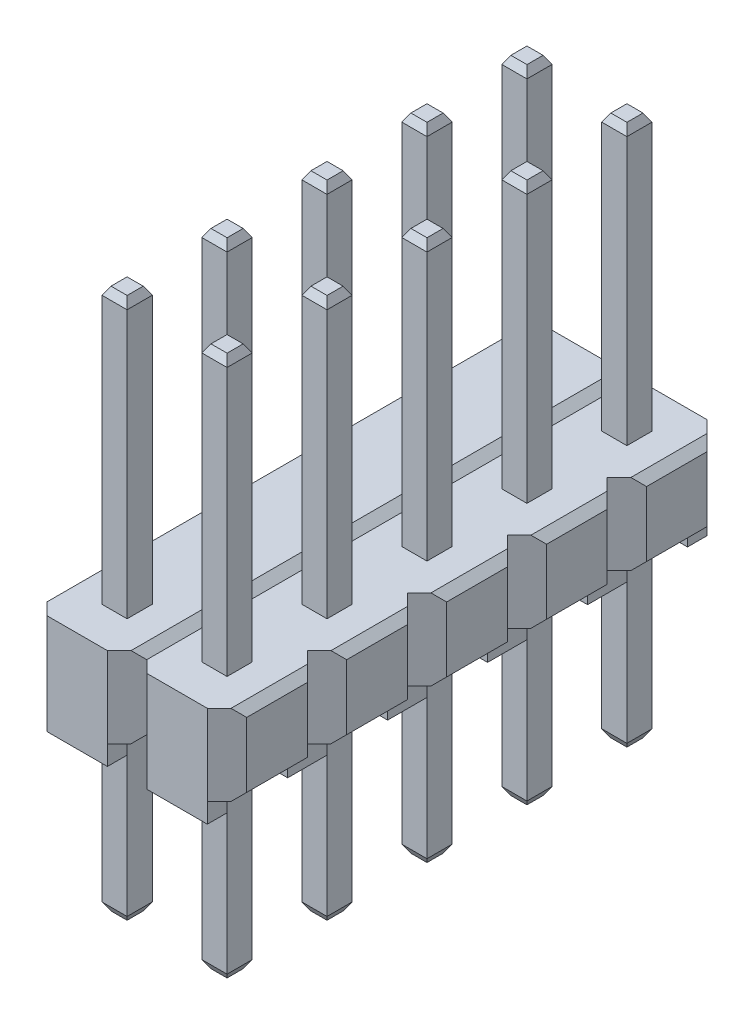
from build123d import *
from OCP.BRepFilletAPI import BRepFilletAPI_MakeChamfer

# Parameters (mm, degrees)
SKETCH1_W                = 0.64
SKETCH1_H                = 0.64
BOSS_EXTRUDE1_DEPTH      = 2.05
CUT_EXTRUDE1_DEPTH       = 10
SKETCH3_W                = 1.54
SKETCH3_H                = 0.5
SKETCH3_H_2              = 1
BOSS_EXTRUDE2_DEPTH      = 0.5
BOSS_EXTRUDE3_DEPTH      = 7
BOSS_EXTRUDE3_DEPTH_BACK = 6.75
SKETCH4_W                = 0.64
SKETCH4_H                = 0.64
CHAMFER1_SIZE            = 0.2
CHAMFER1_SIZE2           = 0.115470054
SKETCH5_R                = 0.125
CUT_EXTRUDE2_DEPTH       = 1
SCALE1_SCALE             = 0.5


with BuildPart() as part:
    # Sketch1 → Boss-Extrude1 (new body)
    with BuildSketch(Plane(origin=(0, 0, 0), x_dir=(1, 0, 0), z_dir=(0, 1, 0))):
        Polygon((2.04, 1.27), (2.54, 0.77), (2.54, -0.77), (2.04, -1.27), (2.54, -1.77), (2.54, -3.31), (2.04, -3.81), (2.54, -4.31), (2.54, -5.85), (2.04, -6.35), (0.5, -6.35), (0, -5.85), (-0.5, -6.35), (-2.04, -6.35), (-2.54, -5.85), (-2.54, -4.31), (-2.04, -3.81), (-2.54, -3.31), (-2.54, -1.77), (-2.04, -1.27), (-2.54, -0.77), (-2.54, 0.77), (-2.04, 1.27), (-2.54, 1.77), (-2.54, 3.31), (-2.04, 3.81), (-2.54, 4.31), (-2.54, 5.85), (-2.04, 6.35), (-0.5, 6.35), (0, 5.85), (0.5, 6.35), (2.04, 6.35), (2.54, 5.85), (2.54, 4.31), (2.04, 3.81), (2.54, 3.31), (2.54, 1.77), align=None)
        Polygon((0, 0.77), (0.5, 1.27), (0, 1.77), (-0.5, 1.27), align=None, mode=Mode.SUBTRACT)
        Polygon((0, 4.31), (-0.5, 3.81), (0, 3.31), (0.5, 3.81), align=None, mode=Mode.SUBTRACT)
        Polygon((0.5, -1.27), (0, -0.77), (-0.5, -1.27), (0, -1.77), align=None, mode=Mode.SUBTRACT)
        with Locations((-1.27, 0)):
            Rectangle(SKETCH1_W, SKETCH1_H, mode=Mode.SUBTRACT)
        with Locations((1.27, 0)):
            Rectangle(SKETCH1_W, SKETCH1_H, mode=Mode.SUBTRACT)
        with Locations((1.27, 5.08)):
            Rectangle(SKETCH1_W, SKETCH1_H, mode=Mode.SUBTRACT)
        with Locations((1.27, 2.54)):
            Rectangle(SKETCH1_W, SKETCH1_H, mode=Mode.SUBTRACT)
        with Locations((-1.27, 2.54)):
            Rectangle(SKETCH1_W, SKETCH1_H, mode=Mode.SUBTRACT)
        Polygon((0, -4.31), (0.5, -3.81), (0, -3.31), (-0.5, -3.81), align=None, mode=Mode.SUBTRACT)
        with Locations((-1.27, 5.08)):
            Rectangle(SKETCH1_W, SKETCH1_H, mode=Mode.SUBTRACT)
        with Locations((-1.27, -5.08)):
            Rectangle(SKETCH1_W, SKETCH1_H, mode=Mode.SUBTRACT)
        with Locations((1.27, -5.08)):
            Rectangle(SKETCH1_W, SKETCH1_H, mode=Mode.SUBTRACT)
        with Locations((1.27, -2.54)):
            Rectangle(SKETCH1_W, SKETCH1_H, mode=Mode.SUBTRACT)
        with Locations((-1.27, -2.54)):
            Rectangle(SKETCH1_W, SKETCH1_H, mode=Mode.SUBTRACT)
    extrude(amount=-BOSS_EXTRUDE1_DEPTH)

    # Sketch2 → Cut-Extrude1 (cut, symmetric)
    with BuildSketch(Plane.XY):
        Polygon((-2.54, -0.2), (-2.34, 0), (-2.54, 0), align=None)
        Polygon((-0.2, 0), (0.2, 0), (0, -0.2), align=None)
        Polygon((2.54, 0), (2.34, 0), (2.54, -0.2), align=None)
        Polygon((2.54, -1.85), (2.54, -2.05), (2.34, -2.05), align=None)
        Polygon((0, -1.85), (-0.2, -2.05), (0.2, -2.05), align=None)
        Polygon((-2.54, -2.05), (-2.54, -1.85), (-2.34, -2.05), align=None)
    extrude(amount=CUT_EXTRUDE1_DEPTH, both=True, mode=Mode.SUBTRACT)

    # Sketch3 → Boss-Extrude2 (add)
    with BuildSketch(Plane.XZ.offset(2.05)):
        with Locations((-1.27, 6.1)):
            Rectangle(SKETCH3_W, SKETCH3_H)
        with Locations((1.27, 6.1)):
            Rectangle(SKETCH3_W, SKETCH3_H)
        with Locations((-1.27, -1.27)):
            Rectangle(SKETCH3_W, SKETCH3_H_2)
        with Locations((1.27, -1.27)):
            Rectangle(SKETCH3_W, SKETCH3_H_2)
        with Locations((-1.27, -3.81)):
            Rectangle(SKETCH3_W, SKETCH3_H_2)
        with Locations((1.27, -3.81)):
            Rectangle(SKETCH3_W, SKETCH3_H_2)
        with Locations((-1.27, -6.1)):
            Rectangle(SKETCH3_W, SKETCH3_H)
        with Locations((1.27, -6.1)):
            Rectangle(SKETCH3_W, SKETCH3_H)
        with Locations((-1.27, 3.81)):
            Rectangle(SKETCH3_W, SKETCH3_H_2)
        with Locations((-1.27, 1.27)):
            Rectangle(SKETCH3_W, SKETCH3_H_2)
        with Locations((1.27, 3.81)):
            Rectangle(SKETCH3_W, SKETCH3_H_2)
        with Locations((1.27, 1.27)):
            Rectangle(SKETCH3_W, SKETCH3_H_2)
    extrude(amount=BOSS_EXTRUDE2_DEPTH)

    # Sketch4 → Boss-Extrude3 (add, two sides: drawn at the far end of the back side and taken through both)
    with BuildSketch(Plane(origin=(0, 0, 0), x_dir=(1, 0, 0), z_dir=(0, 1, 0)).offset(-BOSS_EXTRUDE3_DEPTH_BACK)):
        with Locations((-1.27, 5.08)):
            Rectangle(SKETCH4_W, SKETCH4_H)
        with Locations((1.27, 5.08)):
            Rectangle(SKETCH4_W, SKETCH4_H)
        with Locations((-1.27, 2.54)):
            Rectangle(SKETCH4_W, SKETCH4_H)
        with Locations((1.27, 2.54)):
            Rectangle(SKETCH4_W, SKETCH4_H)
        with Locations((-1.27, 0)):
            Rectangle(SKETCH4_W, SKETCH4_H)
        with Locations((1.27, 0)):
            Rectangle(SKETCH4_W, SKETCH4_H)
        with Locations((-1.27, -2.54)):
            Rectangle(SKETCH4_W, SKETCH4_H)
        with Locations((1.27, -2.54)):
            Rectangle(SKETCH4_W, SKETCH4_H)
        with Locations((-1.27, -5.08)):
            Rectangle(SKETCH4_W, SKETCH4_H)
        with Locations((1.27, -5.08)):
            Rectangle(SKETCH4_W, SKETCH4_H)
    extrude(amount=BOSS_EXTRUDE3_DEPTH + BOSS_EXTRUDE3_DEPTH_BACK)

    # Chamfer1: one chamfer whose edges measure the first distance from different faces: ONE call of the kernel's chamfer builder (chamfer() names one face for all edges)
    chamfer1_edges_1 = [part.edges().sort_by_distance(p)[0] for p in [
        (-1.59, -6.75, -5.08),
    ]]
    chamfer1_side_1 = [part.faces().sort_by_distance(p)[0] for p in [
        (-1.59, -4.4, -5.08),
    ]]
    chamfer1_edges_2 = [part.edges().sort_by_distance(p)[0] for p in [
        (-1.27, -6.75, -5.4),
    ]]
    chamfer1_side_2 = [part.faces().sort_by_distance(p)[0] for p in [
        (-1.27, -4.4, -5.4),
    ]]
    chamfer1_edges_3 = [part.edges().sort_by_distance(p)[0] for p in [
        (-0.95, -6.75, -5.08),
    ]]
    chamfer1_side_3 = [part.faces().sort_by_distance(p)[0] for p in [
        (-0.95, -4.4, -5.08),
    ]]
    chamfer1_edges_4 = [part.edges().sort_by_distance(p)[0] for p in [
        (-1.27, -6.75, -4.76),
    ]]
    chamfer1_side_4 = [part.faces().sort_by_distance(p)[0] for p in [
        (-1.27, -4.4, -4.76),
    ]]
    chamfer1_edges_5 = [part.edges().sort_by_distance(p)[0] for p in [
        (-1.59, 7, -5.08),
    ]]
    chamfer1_side_5 = [part.faces().sort_by_distance(p)[0] for p in [
        (-1.59, 3.5, -5.08),
    ]]
    chamfer1_edges_6 = [part.edges().sort_by_distance(p)[0] for p in [
        (-1.27, 7, -4.76),
    ]]
    chamfer1_side_6 = [part.faces().sort_by_distance(p)[0] for p in [
        (-1.27, 3.5, -4.76),
    ]]
    chamfer1_edges_7 = [part.edges().sort_by_distance(p)[0] for p in [
        (-0.95, 7, -5.08),
    ]]
    chamfer1_side_7 = [part.faces().sort_by_distance(p)[0] for p in [
        (-0.95, 3.5, -5.08),
    ]]
    chamfer1_edges_8 = [part.edges().sort_by_distance(p)[0] for p in [
        (-1.27, 7, -5.4),
    ]]
    chamfer1_side_8 = [part.faces().sort_by_distance(p)[0] for p in [
        (-1.27, 3.5, -5.4),
    ]]
    chamfer1_edges_9 = [part.edges().sort_by_distance(p)[0] for p in [
        (0.95, -6.75, -5.08),
    ]]
    chamfer1_side_9 = [part.faces().sort_by_distance(p)[0] for p in [
        (0.95, -4.4, -5.08),
    ]]
    chamfer1_edges_10 = [part.edges().sort_by_distance(p)[0] for p in [
        (1.27, -6.75, -5.4),
    ]]
    chamfer1_side_10 = [part.faces().sort_by_distance(p)[0] for p in [
        (1.27, -4.4, -5.4),
    ]]
    chamfer1_edges_11 = [part.edges().sort_by_distance(p)[0] for p in [
        (1.59, -6.75, -5.08),
    ]]
    chamfer1_side_11 = [part.faces().sort_by_distance(p)[0] for p in [
        (1.59, -4.4, -5.08),
    ]]
    chamfer1_edges_12 = [part.edges().sort_by_distance(p)[0] for p in [
        (1.27, -6.75, -4.76),
    ]]
    chamfer1_side_12 = [part.faces().sort_by_distance(p)[0] for p in [
        (1.27, -4.4, -4.76),
    ]]
    chamfer1_edges_13 = [part.edges().sort_by_distance(p)[0] for p in [
        (0.95, 7, -5.08),
    ]]
    chamfer1_side_13 = [part.faces().sort_by_distance(p)[0] for p in [
        (0.95, 3.5, -5.08),
    ]]
    chamfer1_edges_14 = [part.edges().sort_by_distance(p)[0] for p in [
        (1.27, 7, -4.76),
    ]]
    chamfer1_side_14 = [part.faces().sort_by_distance(p)[0] for p in [
        (1.27, 3.5, -4.76),
    ]]
    chamfer1_edges_15 = [part.edges().sort_by_distance(p)[0] for p in [
        (1.59, 7, -5.08),
    ]]
    chamfer1_side_15 = [part.faces().sort_by_distance(p)[0] for p in [
        (1.59, 3.5, -5.08),
    ]]
    chamfer1_edges_16 = [part.edges().sort_by_distance(p)[0] for p in [
        (1.27, 7, -5.4),
    ]]
    chamfer1_side_16 = [part.faces().sort_by_distance(p)[0] for p in [
        (1.27, 3.5, -5.4),
    ]]
    chamfer1_edges_17 = [part.edges().sort_by_distance(p)[0] for p in [
        (-1.59, -6.75, -2.54),
    ]]
    chamfer1_side_17 = [part.faces().sort_by_distance(p)[0] for p in [
        (-1.59, -4.4, -2.54),
    ]]
    chamfer1_edges_18 = [part.edges().sort_by_distance(p)[0] for p in [
        (-1.27, -6.75, -2.86),
    ]]
    chamfer1_side_18 = [part.faces().sort_by_distance(p)[0] for p in [
        (-1.27, -4.4, -2.86),
    ]]
    chamfer1_edges_19 = [part.edges().sort_by_distance(p)[0] for p in [
        (-0.95, -6.75, -2.54),
    ]]
    chamfer1_side_19 = [part.faces().sort_by_distance(p)[0] for p in [
        (-0.95, -4.4, -2.54),
    ]]
    chamfer1_edges_20 = [part.edges().sort_by_distance(p)[0] for p in [
        (-1.27, -6.75, -2.22),
    ]]
    chamfer1_side_20 = [part.faces().sort_by_distance(p)[0] for p in [
        (-1.27, -4.4, -2.22),
    ]]
    chamfer1_edges_21 = [part.edges().sort_by_distance(p)[0] for p in [
        (-1.59, 7, -2.54),
    ]]
    chamfer1_side_21 = [part.faces().sort_by_distance(p)[0] for p in [
        (-1.59, 3.5, -2.54),
    ]]
    chamfer1_edges_22 = [part.edges().sort_by_distance(p)[0] for p in [
        (-1.27, 7, -2.22),
    ]]
    chamfer1_side_22 = [part.faces().sort_by_distance(p)[0] for p in [
        (-1.27, 3.5, -2.22),
    ]]
    chamfer1_edges_23 = [part.edges().sort_by_distance(p)[0] for p in [
        (-0.95, 7, -2.54),
    ]]
    chamfer1_side_23 = [part.faces().sort_by_distance(p)[0] for p in [
        (-0.95, 3.5, -2.54),
    ]]
    chamfer1_edges_24 = [part.edges().sort_by_distance(p)[0] for p in [
        (-1.27, 7, -2.86),
    ]]
    chamfer1_side_24 = [part.faces().sort_by_distance(p)[0] for p in [
        (-1.27, 3.5, -2.86),
    ]]
    chamfer1_edges_25 = [part.edges().sort_by_distance(p)[0] for p in [
        (0.95, -6.75, -2.54),
    ]]
    chamfer1_side_25 = [part.faces().sort_by_distance(p)[0] for p in [
        (0.95, -4.4, -2.54),
    ]]
    chamfer1_edges_26 = [part.edges().sort_by_distance(p)[0] for p in [
        (1.27, -6.75, -2.86),
    ]]
    chamfer1_side_26 = [part.faces().sort_by_distance(p)[0] for p in [
        (1.27, -4.4, -2.86),
    ]]
    chamfer1_edges_27 = [part.edges().sort_by_distance(p)[0] for p in [
        (1.59, -6.75, -2.54),
    ]]
    chamfer1_side_27 = [part.faces().sort_by_distance(p)[0] for p in [
        (1.59, -4.4, -2.54),
    ]]
    chamfer1_edges_28 = [part.edges().sort_by_distance(p)[0] for p in [
        (1.27, -6.75, -2.22),
    ]]
    chamfer1_side_28 = [part.faces().sort_by_distance(p)[0] for p in [
        (1.27, -4.4, -2.22),
    ]]
    chamfer1_edges_29 = [part.edges().sort_by_distance(p)[0] for p in [
        (0.95, 7, -2.54),
    ]]
    chamfer1_side_29 = [part.faces().sort_by_distance(p)[0] for p in [
        (0.95, 3.5, -2.54),
    ]]
    chamfer1_edges_30 = [part.edges().sort_by_distance(p)[0] for p in [
        (1.27, 7, -2.22),
    ]]
    chamfer1_side_30 = [part.faces().sort_by_distance(p)[0] for p in [
        (1.27, 3.5, -2.22),
    ]]
    chamfer1_edges_31 = [part.edges().sort_by_distance(p)[0] for p in [
        (1.59, 7, -2.54),
    ]]
    chamfer1_side_31 = [part.faces().sort_by_distance(p)[0] for p in [
        (1.59, 3.5, -2.54),
    ]]
    chamfer1_edges_32 = [part.edges().sort_by_distance(p)[0] for p in [
        (1.27, 7, -2.86),
    ]]
    chamfer1_side_32 = [part.faces().sort_by_distance(p)[0] for p in [
        (1.27, 3.5, -2.86),
    ]]
    chamfer1_edges_33 = [part.edges().sort_by_distance(p)[0] for p in [
        (-1.59, -6.75, 0),
    ]]
    chamfer1_side_33 = [part.faces().sort_by_distance(p)[0] for p in [
        (-1.59, -4.4, 0),
    ]]
    chamfer1_edges_34 = [part.edges().sort_by_distance(p)[0] for p in [
        (-1.27, -6.75, -0.32),
    ]]
    chamfer1_side_34 = [part.faces().sort_by_distance(p)[0] for p in [
        (-1.27, -4.4, -0.32),
    ]]
    chamfer1_edges_35 = [part.edges().sort_by_distance(p)[0] for p in [
        (-0.95, -6.75, 0),
    ]]
    chamfer1_side_35 = [part.faces().sort_by_distance(p)[0] for p in [
        (-0.95, -4.4, 0),
    ]]
    chamfer1_edges_36 = [part.edges().sort_by_distance(p)[0] for p in [
        (-1.27, -6.75, 0.32),
    ]]
    chamfer1_side_36 = [part.faces().sort_by_distance(p)[0] for p in [
        (-1.27, -4.4, 0.32),
    ]]
    chamfer1_edges_37 = [part.edges().sort_by_distance(p)[0] for p in [
        (-1.59, 7, 0),
    ]]
    chamfer1_side_37 = [part.faces().sort_by_distance(p)[0] for p in [
        (-1.59, 3.5, 0),
    ]]
    chamfer1_edges_38 = [part.edges().sort_by_distance(p)[0] for p in [
        (-1.27, 7, 0.32),
    ]]
    chamfer1_side_38 = [part.faces().sort_by_distance(p)[0] for p in [
        (-1.27, 3.5, 0.32),
    ]]
    chamfer1_edges_39 = [part.edges().sort_by_distance(p)[0] for p in [
        (-0.95, 7, 0),
    ]]
    chamfer1_side_39 = [part.faces().sort_by_distance(p)[0] for p in [
        (-0.95, 3.5, 0),
    ]]
    chamfer1_edges_40 = [part.edges().sort_by_distance(p)[0] for p in [
        (-1.27, 7, -0.32),
    ]]
    chamfer1_side_40 = [part.faces().sort_by_distance(p)[0] for p in [
        (-1.27, 3.5, -0.32),
    ]]
    chamfer1_edges_41 = [part.edges().sort_by_distance(p)[0] for p in [
        (0.95, -6.75, 0),
    ]]
    chamfer1_side_41 = [part.faces().sort_by_distance(p)[0] for p in [
        (0.95, -4.4, 0),
    ]]
    chamfer1_edges_42 = [part.edges().sort_by_distance(p)[0] for p in [
        (1.27, -6.75, -0.32),
    ]]
    chamfer1_side_42 = [part.faces().sort_by_distance(p)[0] for p in [
        (1.27, -4.4, -0.32),
    ]]
    chamfer1_edges_43 = [part.edges().sort_by_distance(p)[0] for p in [
        (1.59, -6.75, 0),
    ]]
    chamfer1_side_43 = [part.faces().sort_by_distance(p)[0] for p in [
        (1.59, -4.4, 0),
    ]]
    chamfer1_edges_44 = [part.edges().sort_by_distance(p)[0] for p in [
        (1.27, -6.75, 0.32),
    ]]
    chamfer1_side_44 = [part.faces().sort_by_distance(p)[0] for p in [
        (1.27, -4.4, 0.32),
    ]]
    chamfer1_edges_45 = [part.edges().sort_by_distance(p)[0] for p in [
        (0.95, 7, 0),
    ]]
    chamfer1_side_45 = [part.faces().sort_by_distance(p)[0] for p in [
        (0.95, 3.5, 0),
    ]]
    chamfer1_edges_46 = [part.edges().sort_by_distance(p)[0] for p in [
        (1.27, 7, 0.32),
    ]]
    chamfer1_side_46 = [part.faces().sort_by_distance(p)[0] for p in [
        (1.27, 3.5, 0.32),
    ]]
    chamfer1_edges_47 = [part.edges().sort_by_distance(p)[0] for p in [
        (1.59, 7, 0),
    ]]
    chamfer1_side_47 = [part.faces().sort_by_distance(p)[0] for p in [
        (1.59, 3.5, 0),
    ]]
    chamfer1_edges_48 = [part.edges().sort_by_distance(p)[0] for p in [
        (1.27, 7, -0.32),
    ]]
    chamfer1_side_48 = [part.faces().sort_by_distance(p)[0] for p in [
        (1.27, 3.5, -0.32),
    ]]
    chamfer1_edges_49 = [part.edges().sort_by_distance(p)[0] for p in [
        (-1.59, -6.75, 2.54),
    ]]
    chamfer1_side_49 = [part.faces().sort_by_distance(p)[0] for p in [
        (-1.59, -4.4, 2.54),
    ]]
    chamfer1_edges_50 = [part.edges().sort_by_distance(p)[0] for p in [
        (-1.27, -6.75, 2.22),
    ]]
    chamfer1_side_50 = [part.faces().sort_by_distance(p)[0] for p in [
        (-1.27, -4.4, 2.22),
    ]]
    chamfer1_edges_51 = [part.edges().sort_by_distance(p)[0] for p in [
        (-0.95, -6.75, 2.54),
    ]]
    chamfer1_side_51 = [part.faces().sort_by_distance(p)[0] for p in [
        (-0.95, -4.4, 2.54),
    ]]
    chamfer1_edges_52 = [part.edges().sort_by_distance(p)[0] for p in [
        (-1.27, -6.75, 2.86),
    ]]
    chamfer1_side_52 = [part.faces().sort_by_distance(p)[0] for p in [
        (-1.27, -4.4, 2.86),
    ]]
    chamfer1_edges_53 = [part.edges().sort_by_distance(p)[0] for p in [
        (-1.59, 7, 2.54),
    ]]
    chamfer1_side_53 = [part.faces().sort_by_distance(p)[0] for p in [
        (-1.59, 3.5, 2.54),
    ]]
    chamfer1_edges_54 = [part.edges().sort_by_distance(p)[0] for p in [
        (-1.27, 7, 2.86),
    ]]
    chamfer1_side_54 = [part.faces().sort_by_distance(p)[0] for p in [
        (-1.27, 3.5, 2.86),
    ]]
    chamfer1_edges_55 = [part.edges().sort_by_distance(p)[0] for p in [
        (-0.95, 7, 2.54),
    ]]
    chamfer1_side_55 = [part.faces().sort_by_distance(p)[0] for p in [
        (-0.95, 3.5, 2.54),
    ]]
    chamfer1_edges_56 = [part.edges().sort_by_distance(p)[0] for p in [
        (-1.27, 7, 2.22),
    ]]
    chamfer1_side_56 = [part.faces().sort_by_distance(p)[0] for p in [
        (-1.27, 3.5, 2.22),
    ]]
    chamfer1_edges_57 = [part.edges().sort_by_distance(p)[0] for p in [
        (0.95, -6.75, 2.54),
    ]]
    chamfer1_side_57 = [part.faces().sort_by_distance(p)[0] for p in [
        (0.95, -4.4, 2.54),
    ]]
    chamfer1_edges_58 = [part.edges().sort_by_distance(p)[0] for p in [
        (1.27, -6.75, 2.22),
    ]]
    chamfer1_side_58 = [part.faces().sort_by_distance(p)[0] for p in [
        (1.27, -4.4, 2.22),
    ]]
    chamfer1_edges_59 = [part.edges().sort_by_distance(p)[0] for p in [
        (1.59, -6.75, 2.54),
    ]]
    chamfer1_side_59 = [part.faces().sort_by_distance(p)[0] for p in [
        (1.59, -4.4, 2.54),
    ]]
    chamfer1_edges_60 = [part.edges().sort_by_distance(p)[0] for p in [
        (1.27, -6.75, 2.86),
    ]]
    chamfer1_side_60 = [part.faces().sort_by_distance(p)[0] for p in [
        (1.27, -4.4, 2.86),
    ]]
    chamfer1_edges_61 = [part.edges().sort_by_distance(p)[0] for p in [
        (0.95, 7, 2.54),
    ]]
    chamfer1_side_61 = [part.faces().sort_by_distance(p)[0] for p in [
        (0.95, 3.5, 2.54),
    ]]
    chamfer1_edges_62 = [part.edges().sort_by_distance(p)[0] for p in [
        (1.27, 7, 2.86),
    ]]
    chamfer1_side_62 = [part.faces().sort_by_distance(p)[0] for p in [
        (1.27, 3.5, 2.86),
    ]]
    chamfer1_edges_63 = [part.edges().sort_by_distance(p)[0] for p in [
        (1.59, 7, 2.54),
    ]]
    chamfer1_side_63 = [part.faces().sort_by_distance(p)[0] for p in [
        (1.59, 3.5, 2.54),
    ]]
    chamfer1_edges_64 = [part.edges().sort_by_distance(p)[0] for p in [
        (1.27, 7, 2.22),
    ]]
    chamfer1_side_64 = [part.faces().sort_by_distance(p)[0] for p in [
        (1.27, 3.5, 2.22),
    ]]
    chamfer1_edges_65 = [part.edges().sort_by_distance(p)[0] for p in [
        (-1.59, -6.75, 5.08),
    ]]
    chamfer1_side_65 = [part.faces().sort_by_distance(p)[0] for p in [
        (-1.59, -4.4, 5.08),
    ]]
    chamfer1_edges_66 = [part.edges().sort_by_distance(p)[0] for p in [
        (-1.27, -6.75, 4.76),
    ]]
    chamfer1_side_66 = [part.faces().sort_by_distance(p)[0] for p in [
        (-1.27, -4.4, 4.76),
    ]]
    chamfer1_edges_67 = [part.edges().sort_by_distance(p)[0] for p in [
        (-0.95, -6.75, 5.08),
    ]]
    chamfer1_side_67 = [part.faces().sort_by_distance(p)[0] for p in [
        (-0.95, -4.4, 5.08),
    ]]
    chamfer1_edges_68 = [part.edges().sort_by_distance(p)[0] for p in [
        (-1.27, -6.75, 5.4),
    ]]
    chamfer1_side_68 = [part.faces().sort_by_distance(p)[0] for p in [
        (-1.27, -4.4, 5.4),
    ]]
    chamfer1_edges_69 = [part.edges().sort_by_distance(p)[0] for p in [
        (-1.59, 7, 5.08),
    ]]
    chamfer1_side_69 = [part.faces().sort_by_distance(p)[0] for p in [
        (-1.59, 3.5, 5.08),
    ]]
    chamfer1_edges_70 = [part.edges().sort_by_distance(p)[0] for p in [
        (-1.27, 7, 5.4),
    ]]
    chamfer1_side_70 = [part.faces().sort_by_distance(p)[0] for p in [
        (-1.27, 3.5, 5.4),
    ]]
    chamfer1_edges_71 = [part.edges().sort_by_distance(p)[0] for p in [
        (-0.95, 7, 5.08),
    ]]
    chamfer1_side_71 = [part.faces().sort_by_distance(p)[0] for p in [
        (-0.95, 3.5, 5.08),
    ]]
    chamfer1_edges_72 = [part.edges().sort_by_distance(p)[0] for p in [
        (-1.27, 7, 4.76),
    ]]
    chamfer1_side_72 = [part.faces().sort_by_distance(p)[0] for p in [
        (-1.27, 3.5, 4.76),
    ]]
    chamfer1_edges_73 = [part.edges().sort_by_distance(p)[0] for p in [
        (0.95, -6.75, 5.08),
    ]]
    chamfer1_side_73 = [part.faces().sort_by_distance(p)[0] for p in [
        (0.95, -4.4, 5.08),
    ]]
    chamfer1_edges_74 = [part.edges().sort_by_distance(p)[0] for p in [
        (1.27, -6.75, 4.76),
    ]]
    chamfer1_side_74 = [part.faces().sort_by_distance(p)[0] for p in [
        (1.27, -4.4, 4.76),
    ]]
    chamfer1_edges_75 = [part.edges().sort_by_distance(p)[0] for p in [
        (1.59, -6.75, 5.08),
    ]]
    chamfer1_side_75 = [part.faces().sort_by_distance(p)[0] for p in [
        (1.59, -4.4, 5.08),
    ]]
    chamfer1_edges_76 = [part.edges().sort_by_distance(p)[0] for p in [
        (1.27, -6.75, 5.4),
    ]]
    chamfer1_side_76 = [part.faces().sort_by_distance(p)[0] for p in [
        (1.27, -4.4, 5.4),
    ]]
    chamfer1_edges_77 = [part.edges().sort_by_distance(p)[0] for p in [
        (0.95, 7, 5.08),
    ]]
    chamfer1_side_77 = [part.faces().sort_by_distance(p)[0] for p in [
        (0.95, 3.5, 5.08),
    ]]
    chamfer1_edges_78 = [part.edges().sort_by_distance(p)[0] for p in [
        (1.27, 7, 5.4),
    ]]
    chamfer1_side_78 = [part.faces().sort_by_distance(p)[0] for p in [
        (1.27, 3.5, 5.4),
    ]]
    chamfer1_edges_79 = [part.edges().sort_by_distance(p)[0] for p in [
        (1.59, 7, 5.08),
    ]]
    chamfer1_side_79 = [part.faces().sort_by_distance(p)[0] for p in [
        (1.59, 3.5, 5.08),
    ]]
    chamfer1_edges_80 = [part.edges().sort_by_distance(p)[0] for p in [
        (1.27, 7, 4.76),
    ]]
    chamfer1_side_80 = [part.faces().sort_by_distance(p)[0] for p in [
        (1.27, 3.5, 4.76),
    ]]
    chamfer1 = BRepFilletAPI_MakeChamfer(part.part.solid().wrapped)
    for e in chamfer1_edges_1:
        chamfer1.Add(CHAMFER1_SIZE, CHAMFER1_SIZE2, e.wrapped, chamfer1_side_1[0].wrapped)  # the first distance lies on this face
    for e in chamfer1_edges_2:
        chamfer1.Add(CHAMFER1_SIZE, CHAMFER1_SIZE2, e.wrapped, chamfer1_side_2[0].wrapped)  # the first distance lies on this face
    for e in chamfer1_edges_3:
        chamfer1.Add(CHAMFER1_SIZE, CHAMFER1_SIZE2, e.wrapped, chamfer1_side_3[0].wrapped)  # the first distance lies on this face
    for e in chamfer1_edges_4:
        chamfer1.Add(CHAMFER1_SIZE, CHAMFER1_SIZE2, e.wrapped, chamfer1_side_4[0].wrapped)  # the first distance lies on this face
    for e in chamfer1_edges_5:
        chamfer1.Add(CHAMFER1_SIZE, CHAMFER1_SIZE2, e.wrapped, chamfer1_side_5[0].wrapped)  # the first distance lies on this face
    for e in chamfer1_edges_6:
        chamfer1.Add(CHAMFER1_SIZE, CHAMFER1_SIZE2, e.wrapped, chamfer1_side_6[0].wrapped)  # the first distance lies on this face
    for e in chamfer1_edges_7:
        chamfer1.Add(CHAMFER1_SIZE, CHAMFER1_SIZE2, e.wrapped, chamfer1_side_7[0].wrapped)  # the first distance lies on this face
    for e in chamfer1_edges_8:
        chamfer1.Add(CHAMFER1_SIZE, CHAMFER1_SIZE2, e.wrapped, chamfer1_side_8[0].wrapped)  # the first distance lies on this face
    for e in chamfer1_edges_9:
        chamfer1.Add(CHAMFER1_SIZE, CHAMFER1_SIZE2, e.wrapped, chamfer1_side_9[0].wrapped)  # the first distance lies on this face
    for e in chamfer1_edges_10:
        chamfer1.Add(CHAMFER1_SIZE, CHAMFER1_SIZE2, e.wrapped, chamfer1_side_10[0].wrapped)  # the first distance lies on this face
    for e in chamfer1_edges_11:
        chamfer1.Add(CHAMFER1_SIZE, CHAMFER1_SIZE2, e.wrapped, chamfer1_side_11[0].wrapped)  # the first distance lies on this face
    for e in chamfer1_edges_12:
        chamfer1.Add(CHAMFER1_SIZE, CHAMFER1_SIZE2, e.wrapped, chamfer1_side_12[0].wrapped)  # the first distance lies on this face
    for e in chamfer1_edges_13:
        chamfer1.Add(CHAMFER1_SIZE, CHAMFER1_SIZE2, e.wrapped, chamfer1_side_13[0].wrapped)  # the first distance lies on this face
    for e in chamfer1_edges_14:
        chamfer1.Add(CHAMFER1_SIZE, CHAMFER1_SIZE2, e.wrapped, chamfer1_side_14[0].wrapped)  # the first distance lies on this face
    for e in chamfer1_edges_15:
        chamfer1.Add(CHAMFER1_SIZE, CHAMFER1_SIZE2, e.wrapped, chamfer1_side_15[0].wrapped)  # the first distance lies on this face
    for e in chamfer1_edges_16:
        chamfer1.Add(CHAMFER1_SIZE, CHAMFER1_SIZE2, e.wrapped, chamfer1_side_16[0].wrapped)  # the first distance lies on this face
    for e in chamfer1_edges_17:
        chamfer1.Add(CHAMFER1_SIZE, CHAMFER1_SIZE2, e.wrapped, chamfer1_side_17[0].wrapped)  # the first distance lies on this face
    for e in chamfer1_edges_18:
        chamfer1.Add(CHAMFER1_SIZE, CHAMFER1_SIZE2, e.wrapped, chamfer1_side_18[0].wrapped)  # the first distance lies on this face
    for e in chamfer1_edges_19:
        chamfer1.Add(CHAMFER1_SIZE, CHAMFER1_SIZE2, e.wrapped, chamfer1_side_19[0].wrapped)  # the first distance lies on this face
    for e in chamfer1_edges_20:
        chamfer1.Add(CHAMFER1_SIZE, CHAMFER1_SIZE2, e.wrapped, chamfer1_side_20[0].wrapped)  # the first distance lies on this face
    for e in chamfer1_edges_21:
        chamfer1.Add(CHAMFER1_SIZE, CHAMFER1_SIZE2, e.wrapped, chamfer1_side_21[0].wrapped)  # the first distance lies on this face
    for e in chamfer1_edges_22:
        chamfer1.Add(CHAMFER1_SIZE, CHAMFER1_SIZE2, e.wrapped, chamfer1_side_22[0].wrapped)  # the first distance lies on this face
    for e in chamfer1_edges_23:
        chamfer1.Add(CHAMFER1_SIZE, CHAMFER1_SIZE2, e.wrapped, chamfer1_side_23[0].wrapped)  # the first distance lies on this face
    for e in chamfer1_edges_24:
        chamfer1.Add(CHAMFER1_SIZE, CHAMFER1_SIZE2, e.wrapped, chamfer1_side_24[0].wrapped)  # the first distance lies on this face
    for e in chamfer1_edges_25:
        chamfer1.Add(CHAMFER1_SIZE, CHAMFER1_SIZE2, e.wrapped, chamfer1_side_25[0].wrapped)  # the first distance lies on this face
    for e in chamfer1_edges_26:
        chamfer1.Add(CHAMFER1_SIZE, CHAMFER1_SIZE2, e.wrapped, chamfer1_side_26[0].wrapped)  # the first distance lies on this face
    for e in chamfer1_edges_27:
        chamfer1.Add(CHAMFER1_SIZE, CHAMFER1_SIZE2, e.wrapped, chamfer1_side_27[0].wrapped)  # the first distance lies on this face
    for e in chamfer1_edges_28:
        chamfer1.Add(CHAMFER1_SIZE, CHAMFER1_SIZE2, e.wrapped, chamfer1_side_28[0].wrapped)  # the first distance lies on this face
    for e in chamfer1_edges_29:
        chamfer1.Add(CHAMFER1_SIZE, CHAMFER1_SIZE2, e.wrapped, chamfer1_side_29[0].wrapped)  # the first distance lies on this face
    for e in chamfer1_edges_30:
        chamfer1.Add(CHAMFER1_SIZE, CHAMFER1_SIZE2, e.wrapped, chamfer1_side_30[0].wrapped)  # the first distance lies on this face
    for e in chamfer1_edges_31:
        chamfer1.Add(CHAMFER1_SIZE, CHAMFER1_SIZE2, e.wrapped, chamfer1_side_31[0].wrapped)  # the first distance lies on this face
    for e in chamfer1_edges_32:
        chamfer1.Add(CHAMFER1_SIZE, CHAMFER1_SIZE2, e.wrapped, chamfer1_side_32[0].wrapped)  # the first distance lies on this face
    for e in chamfer1_edges_33:
        chamfer1.Add(CHAMFER1_SIZE, CHAMFER1_SIZE2, e.wrapped, chamfer1_side_33[0].wrapped)  # the first distance lies on this face
    for e in chamfer1_edges_34:
        chamfer1.Add(CHAMFER1_SIZE, CHAMFER1_SIZE2, e.wrapped, chamfer1_side_34[0].wrapped)  # the first distance lies on this face
    for e in chamfer1_edges_35:
        chamfer1.Add(CHAMFER1_SIZE, CHAMFER1_SIZE2, e.wrapped, chamfer1_side_35[0].wrapped)  # the first distance lies on this face
    for e in chamfer1_edges_36:
        chamfer1.Add(CHAMFER1_SIZE, CHAMFER1_SIZE2, e.wrapped, chamfer1_side_36[0].wrapped)  # the first distance lies on this face
    for e in chamfer1_edges_37:
        chamfer1.Add(CHAMFER1_SIZE, CHAMFER1_SIZE2, e.wrapped, chamfer1_side_37[0].wrapped)  # the first distance lies on this face
    for e in chamfer1_edges_38:
        chamfer1.Add(CHAMFER1_SIZE, CHAMFER1_SIZE2, e.wrapped, chamfer1_side_38[0].wrapped)  # the first distance lies on this face
    for e in chamfer1_edges_39:
        chamfer1.Add(CHAMFER1_SIZE, CHAMFER1_SIZE2, e.wrapped, chamfer1_side_39[0].wrapped)  # the first distance lies on this face
    for e in chamfer1_edges_40:
        chamfer1.Add(CHAMFER1_SIZE, CHAMFER1_SIZE2, e.wrapped, chamfer1_side_40[0].wrapped)  # the first distance lies on this face
    for e in chamfer1_edges_41:
        chamfer1.Add(CHAMFER1_SIZE, CHAMFER1_SIZE2, e.wrapped, chamfer1_side_41[0].wrapped)  # the first distance lies on this face
    for e in chamfer1_edges_42:
        chamfer1.Add(CHAMFER1_SIZE, CHAMFER1_SIZE2, e.wrapped, chamfer1_side_42[0].wrapped)  # the first distance lies on this face
    for e in chamfer1_edges_43:
        chamfer1.Add(CHAMFER1_SIZE, CHAMFER1_SIZE2, e.wrapped, chamfer1_side_43[0].wrapped)  # the first distance lies on this face
    for e in chamfer1_edges_44:
        chamfer1.Add(CHAMFER1_SIZE, CHAMFER1_SIZE2, e.wrapped, chamfer1_side_44[0].wrapped)  # the first distance lies on this face
    for e in chamfer1_edges_45:
        chamfer1.Add(CHAMFER1_SIZE, CHAMFER1_SIZE2, e.wrapped, chamfer1_side_45[0].wrapped)  # the first distance lies on this face
    for e in chamfer1_edges_46:
        chamfer1.Add(CHAMFER1_SIZE, CHAMFER1_SIZE2, e.wrapped, chamfer1_side_46[0].wrapped)  # the first distance lies on this face
    for e in chamfer1_edges_47:
        chamfer1.Add(CHAMFER1_SIZE, CHAMFER1_SIZE2, e.wrapped, chamfer1_side_47[0].wrapped)  # the first distance lies on this face
    for e in chamfer1_edges_48:
        chamfer1.Add(CHAMFER1_SIZE, CHAMFER1_SIZE2, e.wrapped, chamfer1_side_48[0].wrapped)  # the first distance lies on this face
    for e in chamfer1_edges_49:
        chamfer1.Add(CHAMFER1_SIZE, CHAMFER1_SIZE2, e.wrapped, chamfer1_side_49[0].wrapped)  # the first distance lies on this face
    for e in chamfer1_edges_50:
        chamfer1.Add(CHAMFER1_SIZE, CHAMFER1_SIZE2, e.wrapped, chamfer1_side_50[0].wrapped)  # the first distance lies on this face
    for e in chamfer1_edges_51:
        chamfer1.Add(CHAMFER1_SIZE, CHAMFER1_SIZE2, e.wrapped, chamfer1_side_51[0].wrapped)  # the first distance lies on this face
    for e in chamfer1_edges_52:
        chamfer1.Add(CHAMFER1_SIZE, CHAMFER1_SIZE2, e.wrapped, chamfer1_side_52[0].wrapped)  # the first distance lies on this face
    for e in chamfer1_edges_53:
        chamfer1.Add(CHAMFER1_SIZE, CHAMFER1_SIZE2, e.wrapped, chamfer1_side_53[0].wrapped)  # the first distance lies on this face
    for e in chamfer1_edges_54:
        chamfer1.Add(CHAMFER1_SIZE, CHAMFER1_SIZE2, e.wrapped, chamfer1_side_54[0].wrapped)  # the first distance lies on this face
    for e in chamfer1_edges_55:
        chamfer1.Add(CHAMFER1_SIZE, CHAMFER1_SIZE2, e.wrapped, chamfer1_side_55[0].wrapped)  # the first distance lies on this face
    for e in chamfer1_edges_56:
        chamfer1.Add(CHAMFER1_SIZE, CHAMFER1_SIZE2, e.wrapped, chamfer1_side_56[0].wrapped)  # the first distance lies on this face
    for e in chamfer1_edges_57:
        chamfer1.Add(CHAMFER1_SIZE, CHAMFER1_SIZE2, e.wrapped, chamfer1_side_57[0].wrapped)  # the first distance lies on this face
    for e in chamfer1_edges_58:
        chamfer1.Add(CHAMFER1_SIZE, CHAMFER1_SIZE2, e.wrapped, chamfer1_side_58[0].wrapped)  # the first distance lies on this face
    for e in chamfer1_edges_59:
        chamfer1.Add(CHAMFER1_SIZE, CHAMFER1_SIZE2, e.wrapped, chamfer1_side_59[0].wrapped)  # the first distance lies on this face
    for e in chamfer1_edges_60:
        chamfer1.Add(CHAMFER1_SIZE, CHAMFER1_SIZE2, e.wrapped, chamfer1_side_60[0].wrapped)  # the first distance lies on this face
    for e in chamfer1_edges_61:
        chamfer1.Add(CHAMFER1_SIZE, CHAMFER1_SIZE2, e.wrapped, chamfer1_side_61[0].wrapped)  # the first distance lies on this face
    for e in chamfer1_edges_62:
        chamfer1.Add(CHAMFER1_SIZE, CHAMFER1_SIZE2, e.wrapped, chamfer1_side_62[0].wrapped)  # the first distance lies on this face
    for e in chamfer1_edges_63:
        chamfer1.Add(CHAMFER1_SIZE, CHAMFER1_SIZE2, e.wrapped, chamfer1_side_63[0].wrapped)  # the first distance lies on this face
    for e in chamfer1_edges_64:
        chamfer1.Add(CHAMFER1_SIZE, CHAMFER1_SIZE2, e.wrapped, chamfer1_side_64[0].wrapped)  # the first distance lies on this face
    for e in chamfer1_edges_65:
        chamfer1.Add(CHAMFER1_SIZE, CHAMFER1_SIZE2, e.wrapped, chamfer1_side_65[0].wrapped)  # the first distance lies on this face
    for e in chamfer1_edges_66:
        chamfer1.Add(CHAMFER1_SIZE, CHAMFER1_SIZE2, e.wrapped, chamfer1_side_66[0].wrapped)  # the first distance lies on this face
    for e in chamfer1_edges_67:
        chamfer1.Add(CHAMFER1_SIZE, CHAMFER1_SIZE2, e.wrapped, chamfer1_side_67[0].wrapped)  # the first distance lies on this face
    for e in chamfer1_edges_68:
        chamfer1.Add(CHAMFER1_SIZE, CHAMFER1_SIZE2, e.wrapped, chamfer1_side_68[0].wrapped)  # the first distance lies on this face
    for e in chamfer1_edges_69:
        chamfer1.Add(CHAMFER1_SIZE, CHAMFER1_SIZE2, e.wrapped, chamfer1_side_69[0].wrapped)  # the first distance lies on this face
    for e in chamfer1_edges_70:
        chamfer1.Add(CHAMFER1_SIZE, CHAMFER1_SIZE2, e.wrapped, chamfer1_side_70[0].wrapped)  # the first distance lies on this face
    for e in chamfer1_edges_71:
        chamfer1.Add(CHAMFER1_SIZE, CHAMFER1_SIZE2, e.wrapped, chamfer1_side_71[0].wrapped)  # the first distance lies on this face
    for e in chamfer1_edges_72:
        chamfer1.Add(CHAMFER1_SIZE, CHAMFER1_SIZE2, e.wrapped, chamfer1_side_72[0].wrapped)  # the first distance lies on this face
    for e in chamfer1_edges_73:
        chamfer1.Add(CHAMFER1_SIZE, CHAMFER1_SIZE2, e.wrapped, chamfer1_side_73[0].wrapped)  # the first distance lies on this face
    for e in chamfer1_edges_74:
        chamfer1.Add(CHAMFER1_SIZE, CHAMFER1_SIZE2, e.wrapped, chamfer1_side_74[0].wrapped)  # the first distance lies on this face
    for e in chamfer1_edges_75:
        chamfer1.Add(CHAMFER1_SIZE, CHAMFER1_SIZE2, e.wrapped, chamfer1_side_75[0].wrapped)  # the first distance lies on this face
    for e in chamfer1_edges_76:
        chamfer1.Add(CHAMFER1_SIZE, CHAMFER1_SIZE2, e.wrapped, chamfer1_side_76[0].wrapped)  # the first distance lies on this face
    for e in chamfer1_edges_77:
        chamfer1.Add(CHAMFER1_SIZE, CHAMFER1_SIZE2, e.wrapped, chamfer1_side_77[0].wrapped)  # the first distance lies on this face
    for e in chamfer1_edges_78:
        chamfer1.Add(CHAMFER1_SIZE, CHAMFER1_SIZE2, e.wrapped, chamfer1_side_78[0].wrapped)  # the first distance lies on this face
    for e in chamfer1_edges_79:
        chamfer1.Add(CHAMFER1_SIZE, CHAMFER1_SIZE2, e.wrapped, chamfer1_side_79[0].wrapped)  # the first distance lies on this face
    for e in chamfer1_edges_80:
        chamfer1.Add(CHAMFER1_SIZE, CHAMFER1_SIZE2, e.wrapped, chamfer1_side_80[0].wrapped)  # the first distance lies on this face
    add(Compound.cast(chamfer1.Shape()), mode=Mode.REPLACE)

    # Sketch5 → Cut-Extrude2 (cut)
    with BuildSketch(Plane.XZ.offset(6.75)):
        with Locations(Location((-1.27, -5.08, 0), (0, 0, 270))):
            Circle(SKETCH5_R)
        with Locations(Location((-1.27, 5.08, 0), (0, 0, 270))):
            Circle(SKETCH5_R)
    extrude(amount=-CUT_EXTRUDE2_DEPTH, mode=Mode.SUBTRACT)


with BuildPart() as part_1:
    # Scale1: scaled about (0.000709735, -0.712686661, 0)
    add(part.part.scale(SCALE1_SCALE).moved(Location((0.000354867, -0.35634333, 0))))


solid = part_1.part
